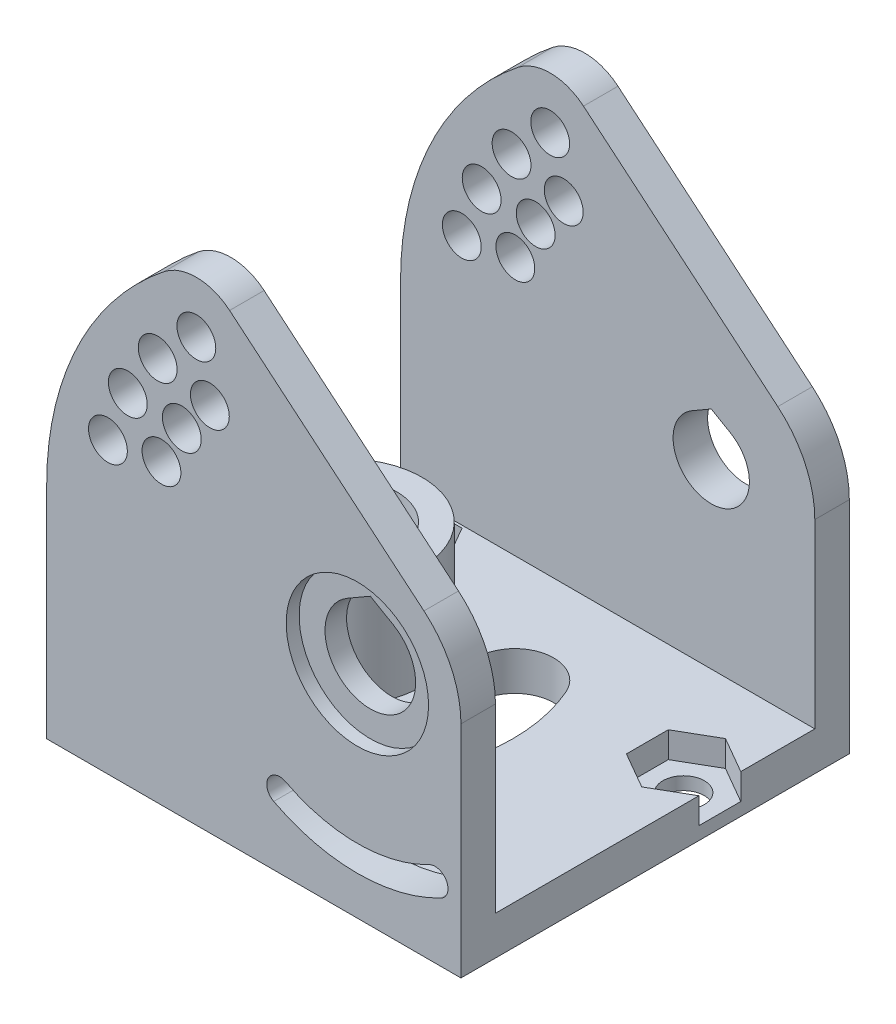
from build123d import *

# Parameters (mm, degrees)
SKETCH1_R           = 6
BOSS_EXTRUDE1_DEPTH = 3
SKETCH1_3_R         = 1.6
BOSS_EXTRUDE5_DEPTH = 1
SKETCH1_6_R         = 6
SKETCH1_6_R_2       = 4.05
BOSS_EXTRUDE6_DEPTH = 11
SKETCH1_7_R         = 4.05
SKETCH1_7_R_2       = 1.5
BOSS_EXTRUDE7_DEPTH = 7
SKETCH2_R           = 1.5
BOSS_EXTRUDE2_DEPTH = 2.666
CUT_EXTRUDE1_DEPTH  = 2.666
CUT_EXTRUDE2_DEPTH  = 2.666
SKETCH3_3_R         = 5.5
CUT_EXTRUDE4_DEPTH  = 1


with BuildPart() as part:
    # Sketch1 → Boss-Extrude1 (new body)
    with BuildSketch(Plane(origin=(0, 0, 0), x_dir=(1, 0, 0), z_dir=(0, 1, 0))):
        Polygon((0, 15), (0, -15), (32, -15), (32, 3.383419246), (29.2, 1.766838493), (26.4, 3.383419246), (26.4, 6.616580754), (29.2, 8.233161507), (32, 6.616580754), (32, 15), align=None)
        with Locations(Location((8, 0, 0), (0, 0, 270))):
            Circle(SKETCH1_R, mode=Mode.SUBTRACT)
        with BuildLine():
            ThreePointArc((19.914696807, 5.2), (21, 0), (19.914696807, -5.2))
            ThreePointArc((19.914696807, -5.2), (15.96515139, -6.749545417), (14.415605973, -2.8))
            ThreePointArc((14.415605973, -2.8), (15, 0), (14.415605973, 2.8))
            ThreePointArc((14.415605973, 2.8), (15.96515139, 6.749545417), (19.914696807, 5.2))
        make_face(mode=Mode.SUBTRACT)
        Polygon((6.566323015, 9.3334), (4.949742261, 6.5334), (1.716580754, 6.5334), (0.1, 9.3334), (1.716580754, 12.1334), (4.949742261, 12.1334), align=None, mode=Mode.SUBTRACT)
    extrude(amount=BOSS_EXTRUDE1_DEPTH)

    # Sketch1<3> → Boss-Extrude5 (add)
    # profile 1 of 2: a face of its own
    with BuildSketch(Plane(origin=(0, 0, 0), x_dir=(1, 0, 0), z_dir=(0, 1, 0))):
        Polygon((29.2, 1.766838493), (32, 3.383419246), (32, 6.616580754), (29.2, 8.233161507), (26.4, 6.616580754), (26.4, 3.383419246), align=None)
        with Locations(Location((29.2, 5, 0), (0, 0, 270))):
            Circle(SKETCH1_3_R, mode=Mode.SUBTRACT)
    # profile 2 of 2: a face of its own
    with BuildSketch(Plane(origin=(0, 0, 0), x_dir=(1, 0, 0), z_dir=(0, 1, 0))):
        Polygon((1.716580754, 6.5334), (4.949742261, 6.5334), (6.566323015, 9.3334), (4.949742261, 12.1334), (1.716580754, 12.1334), (0.1, 9.3334), align=None)
        with Locations(Location((3.333161507, 9.3334, 0), (0, 0, 270))):
            Circle(SKETCH1_3_R, mode=Mode.SUBTRACT)
    extrude(amount=BOSS_EXTRUDE5_DEPTH)

    # Sketch1<6> → Boss-Extrude6 (add)
    with BuildSketch(Plane(origin=(0, 0, 0), x_dir=(1, 0, 0), z_dir=(0, 1, 0))):
        with Locations(Location((8, 0, 0), (0, 0, 270))):
            Circle(SKETCH1_6_R)
        with Locations(Location((8, 0, 0), (0, 0, 270))):
            Circle(SKETCH1_6_R_2, mode=Mode.SUBTRACT)
    extrude(amount=BOSS_EXTRUDE6_DEPTH)

    # Sketch1<7> → Boss-Extrude7 (add)
    with BuildSketch(Plane(origin=(0, 0, 0), x_dir=(1, 0, 0), z_dir=(0, 1, 0))):
        with Locations(Location((8, 0, 0), (0, 0, 270))):
            Circle(SKETCH1_7_R)
        with Locations(Location((8, 0, 0), (0, 0, 270))):
            Circle(SKETCH1_7_R_2, mode=Mode.SUBTRACT)
    extrude(amount=BOSS_EXTRUDE7_DEPTH)

    # Sketch2 → Boss-Extrude2 (add)
    with BuildSketch(Plane.XY.offset(15)):
        with BuildLine():
            ThreePointArc((32, 17), (31.250462296, 20.380946094), (29.142300877, 23.128355545))
            Line((29.142300877, 23.128355545), (14.13095683, 35.724368799))
            ThreePointArc((14.13095683, 35.724368799), (11.613454774, 36.659831241), (9.07176767, 35.792229231))
            ThreePointArc((9.07176767, 35.792229231), (2.386606283, 27.433657654), (0, 17))
            Line((0, 17), (0, 3))
            Line((0, 3), (32, 3))
            Line((32, 3), (32, 17))
        make_face()
        with Locations((4.730842624, 22.357198336)):
            Circle(SKETCH2_R, mode=Mode.SUBTRACT)
        with Locations((6.265744109, 26.24641379)):
            Circle(SKETCH2_R, mode=Mode.SUBTRACT)
        with Locations((8.86645275, 22.972542385)):
            Circle(SKETCH2_R, mode=Mode.SUBTRACT)
        with Locations((10.438918453, 25.988469401)):
            Circle(SKETCH2_R, mode=Mode.SUBTRACT)
        with Locations((8.575717674, 29.731516592)):
            Circle(SKETCH2_R, mode=Mode.SUBTRACT)
        with Locations((12.604068492, 28.611557173)):
            Circle(SKETCH2_R, mode=Mode.SUBTRACT)
        with Locations((11.559806391, 32.660191026)):
            Circle(SKETCH2_R, mode=Mode.SUBTRACT)
    boss_extrude2 = extrude(amount=-BOSS_EXTRUDE2_DEPTH)

    # Mirror1: Boss-Extrude2 across plane
    add(boss_extrude2.mirror(Plane.XY))

    # Sketch3 → Cut-Extrude1 (cut)
    with BuildSketch(Plane.XY.offset(15)):
        with BuildLine():
            Line((22.25, 20.031088913), (24, 21.041451884))
            Line((24, 21.041451884), (25.75, 20.031088913))
            ThreePointArc((25.75, 20.031088913), (24, 13.5), (22.25, 20.031088913))
        make_face()
        with BuildLine():
            ThreePointArc((18.461538462, 6.354557605), (24, 5), (29.538461538, 6.354557605))
            ThreePointArc((29.538461538, 6.354557605), (30.8871202, 5.928975867), (30.461538462, 4.580317206))
            ThreePointArc((30.461538462, 4.580317206), (24, 3), (17.538461538, 4.580317206))
            ThreePointArc((17.538461538, 4.580317206), (17.1128798, 5.928975867), (18.461538462, 6.354557605))
        make_face()
    extrude(amount=-CUT_EXTRUDE1_DEPTH, mode=Mode.SUBTRACT)

    # Sketch4 → Cut-Extrude2 (cut)
    with BuildSketch(Plane.XY.offset(-12.334)):
        with BuildLine():
            Line((22.5275, 19.550444814), (24, 20.400593086))
            Line((24, 20.400593086), (25.4725, 19.550444814))
            ThreePointArc((25.4725, 19.550444814), (24, 14.055), (22.5275, 19.550444814))
        make_face()
    extrude(amount=-CUT_EXTRUDE2_DEPTH, mode=Mode.SUBTRACT)

    # Sketch3<3> → Cut-Extrude4 (cut)
    # profile 1 of 2: a face of its own
    with BuildSketch(Plane.XY.offset(15)):
        with Locations((24, 17)):
            Circle(SKETCH3_3_R)
        with BuildLine():
            Line((22.25, 20.031088913), (24, 21.041451884))
            Line((24, 21.041451884), (25.75, 20.031088913))
            ThreePointArc((25.75, 20.031088913), (24, 13.5), (22.25, 20.031088913))
        make_face(mode=Mode.SUBTRACT)
    # profile 2 of 2: a face of its own
    with BuildSketch(Plane.XY.offset(15)):
        with BuildLine():
            ThreePointArc((17.538461538, 4.580317206), (24, 3), (30.461538462, 4.580317206))
            ThreePointArc((30.461538462, 4.580317206), (30.8871202, 5.928975867), (29.538461538, 6.354557605))
            ThreePointArc((29.538461538, 6.354557605), (24, 5), (18.461538462, 6.354557605))
            ThreePointArc((18.461538462, 6.354557605), (17.1128798, 5.928975867), (17.538461538, 4.580317206))
        make_face()
    extrude(amount=-CUT_EXTRUDE4_DEPTH, mode=Mode.SUBTRACT)


solid = part.part
